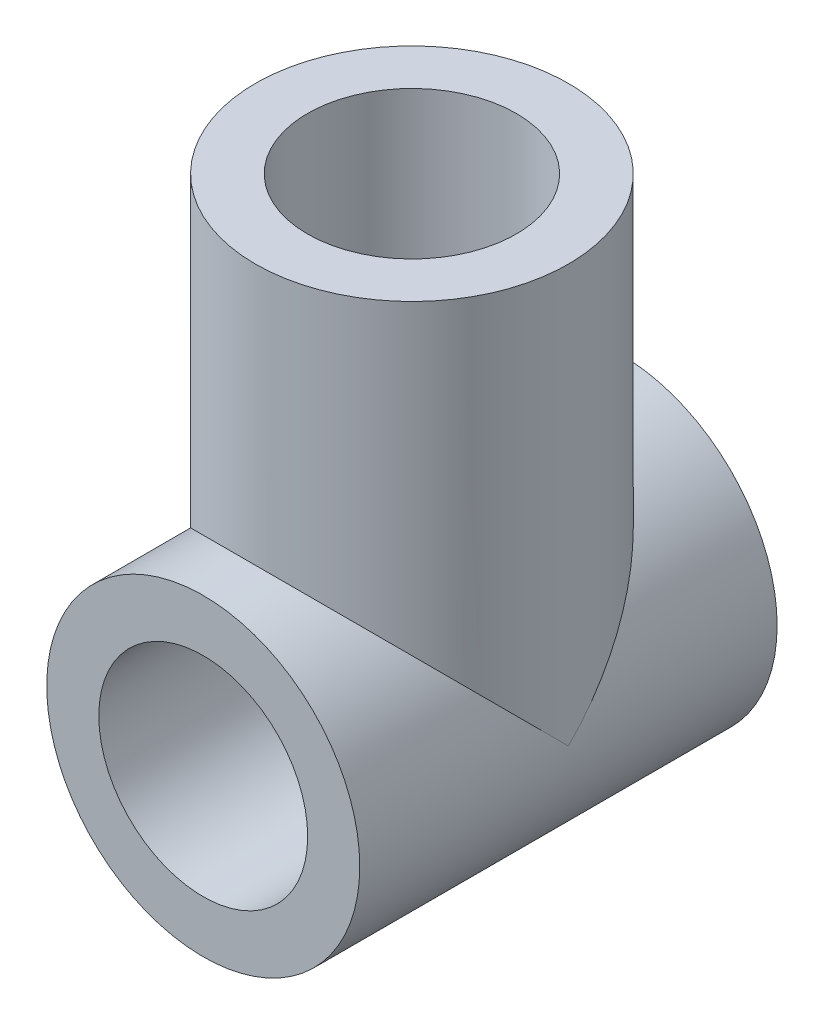
from build123d import *

# Parameters (mm, degrees)
BOSS_EXTRUDE1_DEPTH      = 10
BOSS_EXTRUDE1_DEPTH_BACK = 10
SKETCH1_R                = 7.5
SKETCH3_R                = 7.5
BOSS_EXTRUDE2_DEPTH      = 20
SKETCH4_R                = 5.005
CUT_EXTRUDE2_DEPTH       = 23
SKETCH5_R                = 5.005
CUT_EXTRUDE3_DEPTH       = 9


with BuildPart() as part:
    # Sketch1 → Boss-Extrude1 (new, two sides: drawn at the far end of the back side and taken through both)
    with BuildSketch(Plane.XY.offset(-BOSS_EXTRUDE1_DEPTH_BACK)):
        Circle(SKETCH1_R)
    extrude(amount=BOSS_EXTRUDE1_DEPTH + BOSS_EXTRUDE1_DEPTH_BACK)

    # Sketch3 → Boss-Extrude2 (add)
    with BuildSketch(Plane(origin=(0, 20, 0), x_dir=(1, 0, 0), z_dir=(0, 1, 0))):
        Circle(SKETCH3_R)
    extrude(amount=-BOSS_EXTRUDE2_DEPTH)

    # Sketch4 → Cut-Extrude2 (cut)
    with BuildSketch(Plane.XY.offset(10)):
        Circle(SKETCH4_R)
    extrude(amount=-CUT_EXTRUDE2_DEPTH, mode=Mode.SUBTRACT)

    # Sketch5 → Cut-Extrude3 (cut)
    with BuildSketch(Plane(origin=(0, 20, 0), x_dir=(1, 0, 0), z_dir=(0, 1, 0))):
        Circle(SKETCH5_R)
    extrude(amount=-CUT_EXTRUDE3_DEPTH, mode=Mode.SUBTRACT)


solid = part.part
